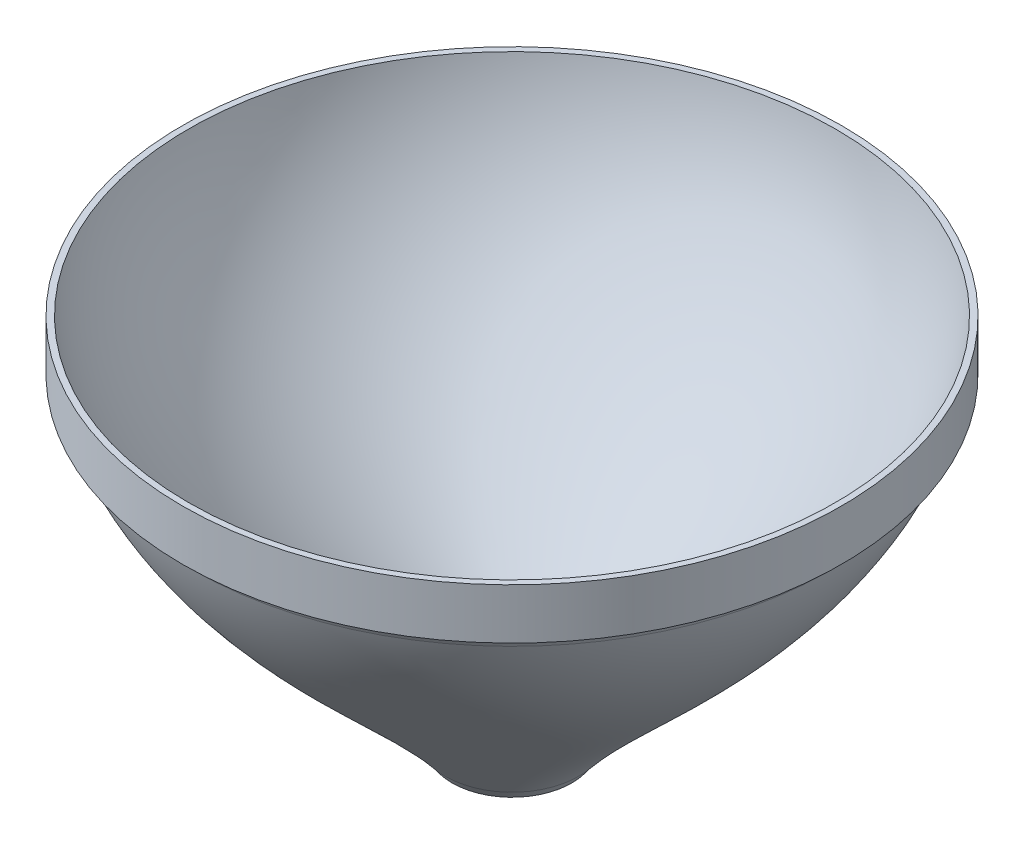
from build123d import *


with BuildPart() as part:
    # Sketch1 → Revolve1 (revolve)
    with BuildSketch(Plane.XY, mode=Mode.PRIVATE) as revolve1_sk:
        with BuildLine():
            Line((18.834212464, 85.656528888), (16.872016179, 85.656528888))
            Line((16.872016179, 85.656528888), (15.982781636, 86.86452803))
            add(Edge.make_bspline(
                [(-17.557551318, 127.375382727), (-17.149252008, 126.282501553), (-16.237853417, 124.119682516), (-14.129979086, 120.024361387), (-9.75405026, 113.3263342), (-3.634824269, 106.585517876), (2.779766009, 100.345416982), (7.538915569, 95.819712917), (11.288948131, 92.106723437), (14.070545225, 89.115850224), (15.353268122, 87.629988), (15.982781636, 86.86452803)],
                knots=[0.117144833, 0.117144833, 0.117144833, 0.117144833, 0.169312009, 0.221479185, 0.325813538, 0.534482242, 0.638816594, 0.743150946, 0.847485298, 0.899652474, 0.95181965, 0.95181965, 0.95181965, 0.95181965], degree=3))
            Line((-17.557551318, 127.375382727), (-18.165787536, 128.746531407))
            Line((-18.165787536, 128.746531407), (-18.965787536, 128.746531407))
            Line((-18.965787536, 128.746531407), (-18.965787536, 135.456528888))
            Line((-18.965787536, 135.456528888), (-18.165787536, 135.456528888))
            add(Edge.make_bspline(
                [(-18.165787536, 135.456528888), (-14.45456026, 112.769537057), (7.622935344, 100.742541923), (18.834212464, 85.656528888)],
                knots=[0, 0, 0, 0, 1, 1, 1, 1], degree=3))
        make_face()
    revolve(revolve1_sk.sketch.rotate(Axis((24.834212464, 148.471380655, 0), (0, -1, 0)), 270), axis=Axis((24.834212464, 148.471380655, 0), (0, -1, 0)))


solid = part.part
